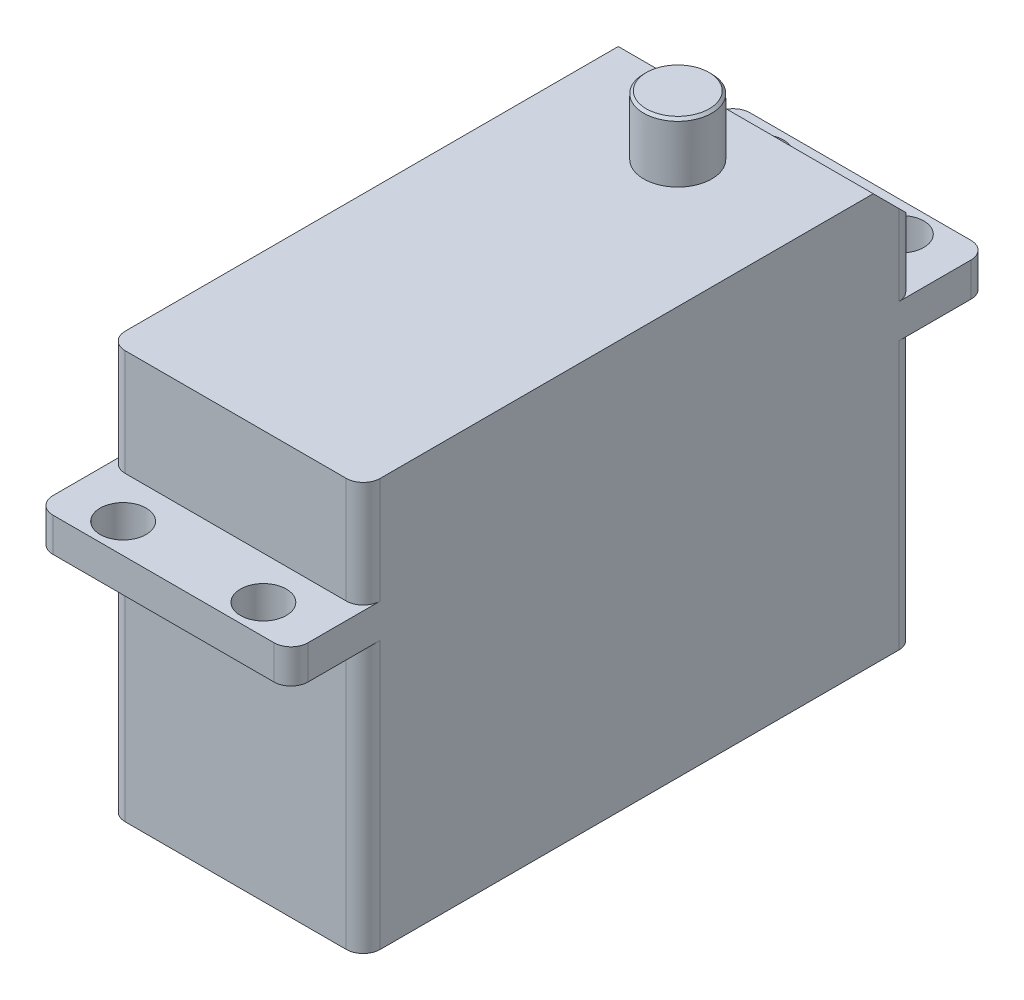
from build123d import *

# Parameters (mm, degrees)
SKETCH_1_W          = 30
SKETCH_1_H          = 65
EXTRUDE_1_DEPTH     = 48
SKETCH_2_W          = 30
SKETCH_2_H          = 82
EXTRUDE_2_DEPTH     = 4
SKETCH_3_R          = 2.7
CUT_EXTRUDE_1_DEPTH = 4
SKETCH_4_R          = 4
EXTRUDE_3_DEPTH     = 7
CHAMFER_1_SIZE      = 0.3
FILLET_1_R          = 2
CHAMFER_2_SIZE      = 5
FILLET_2_R          = 2


with BuildPart() as part:
    # 草图1 → 凸台-拉伸1 (new body)
    with BuildSketch(Plane(origin=(0, 0, 0), x_dir=(1, 0, 0), z_dir=(0, 1, 0))):
        Rectangle(SKETCH_1_W, SKETCH_1_H)
    extrude(amount=EXTRUDE_1_DEPTH)

    # 草图2 → 凸台-拉伸2 (add)
    with BuildSketch(Plane(origin=(0, 35.5, 0), x_dir=(-1, 0, 0), z_dir=(0, -1, 0))):
        Rectangle(SKETCH_2_W, SKETCH_2_H)
    extrude(amount=EXTRUDE_2_DEPTH)

    # 草图3 → 切除-拉伸1 (cut)
    with BuildSketch(Plane(origin=(0, 35.5, 0), x_dir=(1, 0, 0), z_dir=(0, 1, 0))):
        with Locations(Location((-8.25, 37.5, 0), (0, 0, 270))):
            Circle(SKETCH_3_R)
        with Locations(Location((8.25, 37.5, 0), (0, 0, 270))):
            Circle(SKETCH_3_R)
        with Locations(Location((8.25, -37.5, 0), (0, 0, 270))):
            Circle(SKETCH_3_R)
        with Locations(Location((-8.25, -37.5, 0), (0, 0, 270))):
            Circle(SKETCH_3_R)
    extrude(amount=-CUT_EXTRUDE_1_DEPTH, mode=Mode.SUBTRACT)

    # 草图4 → 凸台-拉伸3 (add)
    with BuildSketch(Plane(origin=(0, 48, 0), x_dir=(1, 0, 0), z_dir=(0, 1, 0))):
        with Locations(Location((0, 19.5, 0), (0, 0, 90))):
            Circle(SKETCH_4_R)
    extrude(amount=EXTRUDE_3_DEPTH)

    # 倒角1
    chamfer_1_edges = [part.edges().sort_by_distance(p)[0] for p in [
        (0, 55, -15.5),
    ]]
    chamfer(chamfer_1_edges, length=CHAMFER_1_SIZE)

    # 圆角1
    fillet_1_edges = [part.edges().sort_by_distance(p)[0] for p in [
        (15, 15.75, 32.5),
        (-15, 15.75, 32.5),
        (-15, 15.75, -32.5),
        (15, 15.75, -32.5),
        (15, 41.75, 32.5),
        (-15, 41.75, 32.5),
    ]]
    fillet(fillet_1_edges, radius=FILLET_1_R)

    # 倒角2
    chamfer_2_edges = [part.edges().sort_by_distance(p)[0] for p in [
        (0, 48, -32.5),
    ]]
    chamfer(chamfer_2_edges, length=CHAMFER_2_SIZE)

    # 圆角2
    fillet_2_edges = [part.edges().sort_by_distance(p)[0] for p in [
        (-15, 39.25, -32.5),
        (15, 39.25, -32.5),
        (15, 33.5, -41),
        (-15, 33.5, 41),
        (15, 33.5, 41),
        (-15, 33.5, -41),
    ]]
    fillet(fillet_2_edges, radius=FILLET_2_R)


solid = part.part
